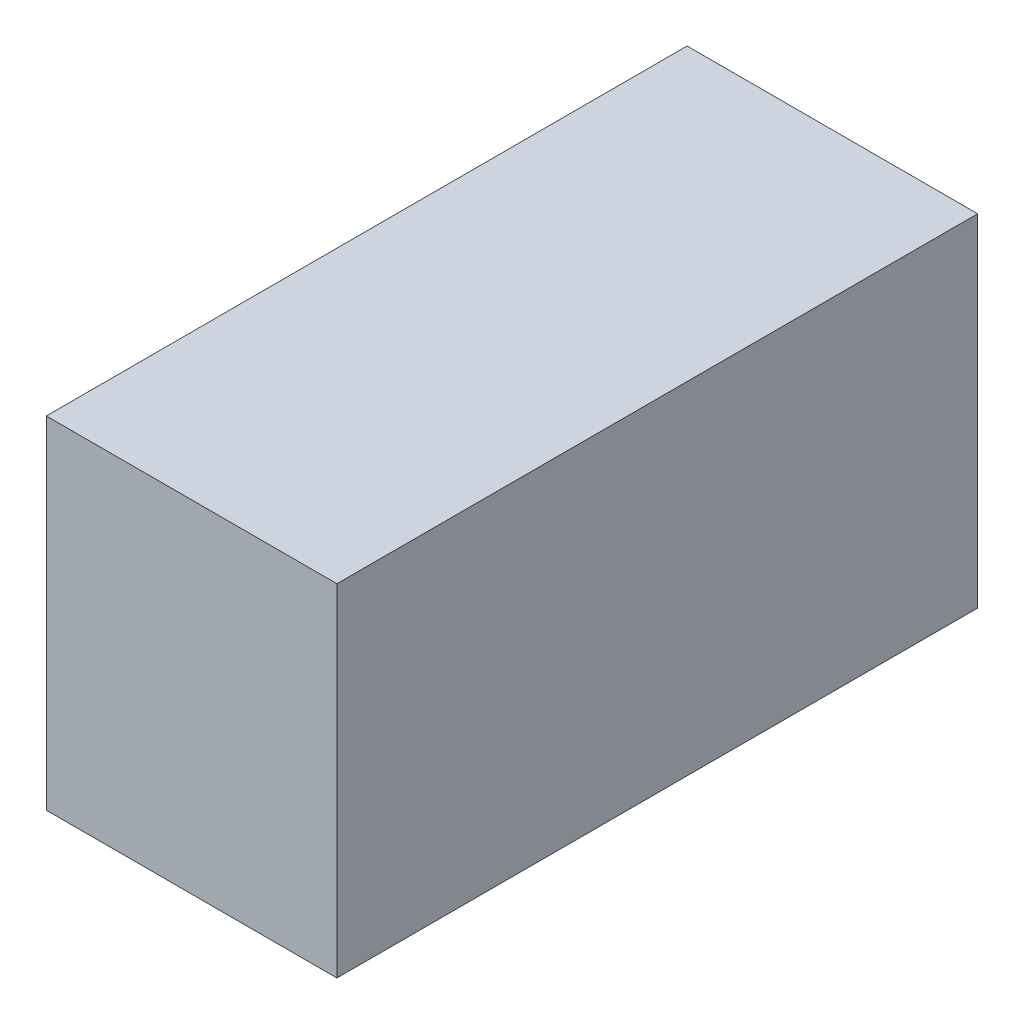
from build123d import *

# Parameters (mm, degrees)
SKETCH1_W      = 20
SKETCH1_H      = 23.5
ENVELOPE_DEPTH = 44.1


with BuildPart() as part:
    # Sketch1 → Envelope (new body)
    with BuildSketch(Plane.XY):
        Rectangle(SKETCH1_W, SKETCH1_H)
    extrude(amount=ENVELOPE_DEPTH)


solid = part.part
